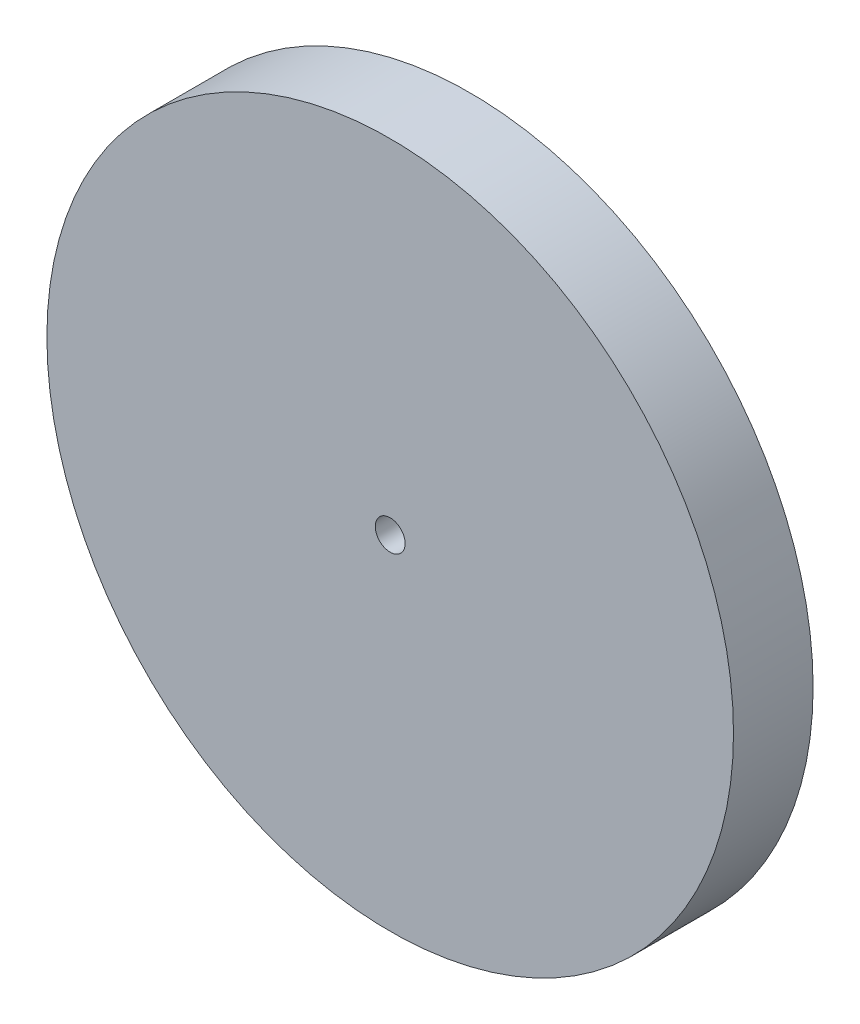
from build123d import *

# Parameters (mm, degrees)
SKETCH2_R           = 34.5
SKETCH2_R_2         = 1.5
BOSS_EXTRUDE1_DEPTH = 8


with BuildPart() as part:
    # Sketch2 → Boss-Extrude1 (new body)
    with BuildSketch(Plane.XY):
        Circle(SKETCH2_R)
        Circle(SKETCH2_R_2, mode=Mode.SUBTRACT)
    extrude(amount=BOSS_EXTRUDE1_DEPTH)


solid = part.part
